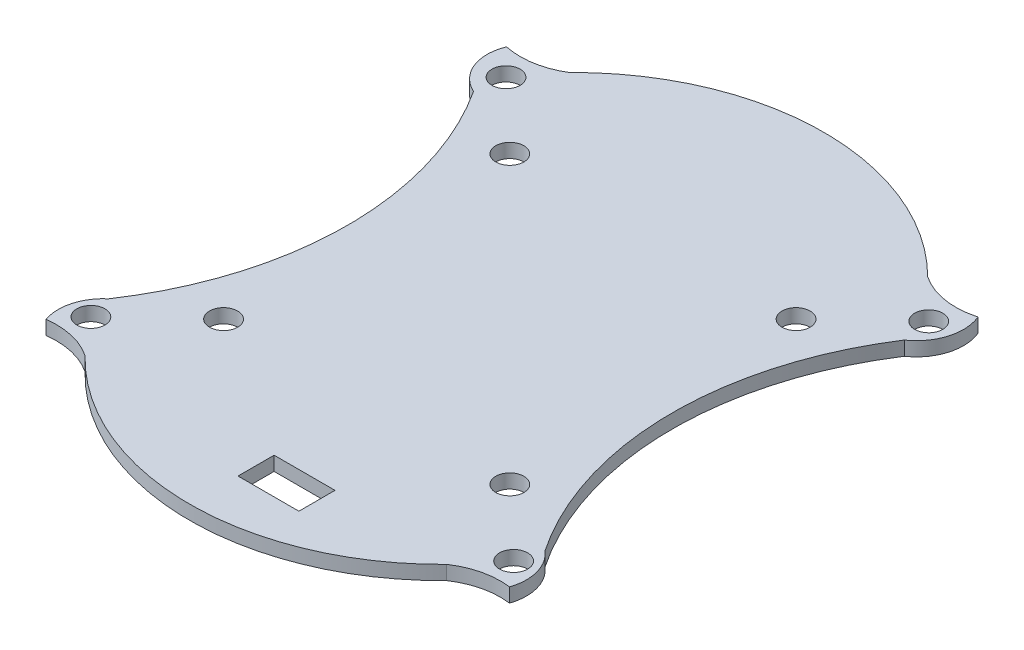
from build123d import *

# Parameters (mm, degrees)
SKETCH2_R           = 1.5
SKETCH2_W           = 6.488584399
SKETCH2_H           = 3.846601045
BOSS_EXTRUDE2_DEPTH = 1.5


with BuildPart() as part:
    # Sketch2 → Boss-Extrude2 (new body)
    with BuildSketch(Plane(origin=(0, 0, 0), x_dir=(1, 0, 0), z_dir=(0, 1, 0))):
        with BuildLine():
            ThreePointArc((23.247996545, -19.500190875), (24.776607327, -21.890134515), (24.695421013, -24.725957202))
            ThreePointArc((24.695421013, -24.725957202), (21.863295263, -24.863949953), (19.264117039, -25.997197864))
            ThreePointArc((19.264117039, -25.997197864), (0, -34.136214734), (-19.264117039, -25.997197864))
            ThreePointArc((-19.264117039, -25.997197864), (-21.863295263, -24.863949953), (-24.695421013, -24.725957202))
            ThreePointArc((-24.695421013, -24.725957202), (-24.776607327, -21.890134515), (-23.247996545, -19.500190875))
            ThreePointArc((-23.247996545, -19.500190875), (-17.299915505, -0.254242625), (-22.945369046, 19.082640433))
            ThreePointArc((-22.945369046, 19.082640433), (-25.316903499, 21.537699802), (-25.294419588, 24.951053966))
            ThreePointArc((-25.294419588, 24.951053966), (-22.344172838, 24.887982121), (-19.582319286, 25.927260189))
            ThreePointArc((-19.582319286, 25.927260189), (-0.66060428, 33.9728721), (18.359891541, 26.163652643))
            ThreePointArc((18.359891541, 26.163652643), (21.442039723, 24.947145004), (24.750195634, 25.135911308))
            ThreePointArc((24.750195634, 25.135911308), (24.924707249, 21.788182903), (22.945369046, 19.082640433))
            ThreePointArc((22.945369046, 19.082640433), (17.299915505, -0.254242625), (23.247996545, -19.500190875))
        make_face()
        with Locations(Location((-15.25, 15.25, 0), (0, 0, 270))):
            Circle(SKETCH2_R, mode=Mode.SUBTRACT)
        with Locations(Location((15.25, 15.25, 0), (0, 0, 270))):
            Circle(SKETCH2_R, mode=Mode.SUBTRACT)
        with Locations(Location((-15.25, -15.25, 0), (0, 0, 270))):
            Circle(SKETCH2_R, mode=Mode.SUBTRACT)
        with Locations(Location((15.25, -15.25, 0), (0, 0, 270))):
            Circle(SKETCH2_R, mode=Mode.SUBTRACT)
        with Locations(Location((-22.519911508, 22.116468281, 0), (0, 0, 270))):
            Circle(SKETCH2_R, mode=Mode.SUBTRACT)
        with Locations(Location((22.519911508, 22.116468281, 0), (0, 0, 270))):
            Circle(SKETCH2_R, mode=Mode.SUBTRACT)
        with Locations(Location((22.519911508, -22.116468281, 0), (0, 0, 270))):
            Circle(SKETCH2_R, mode=Mode.SUBTRACT)
        with Locations(Location((-22.519911508, -22.116468281, 0), (0, 0, 270))):
            Circle(SKETCH2_R, mode=Mode.SUBTRACT)
        with Locations((3.2442922, -27.038937624)):
            Rectangle(SKETCH2_W, SKETCH2_H, mode=Mode.SUBTRACT)
    extrude(amount=BOSS_EXTRUDE2_DEPTH)


solid = part.part
